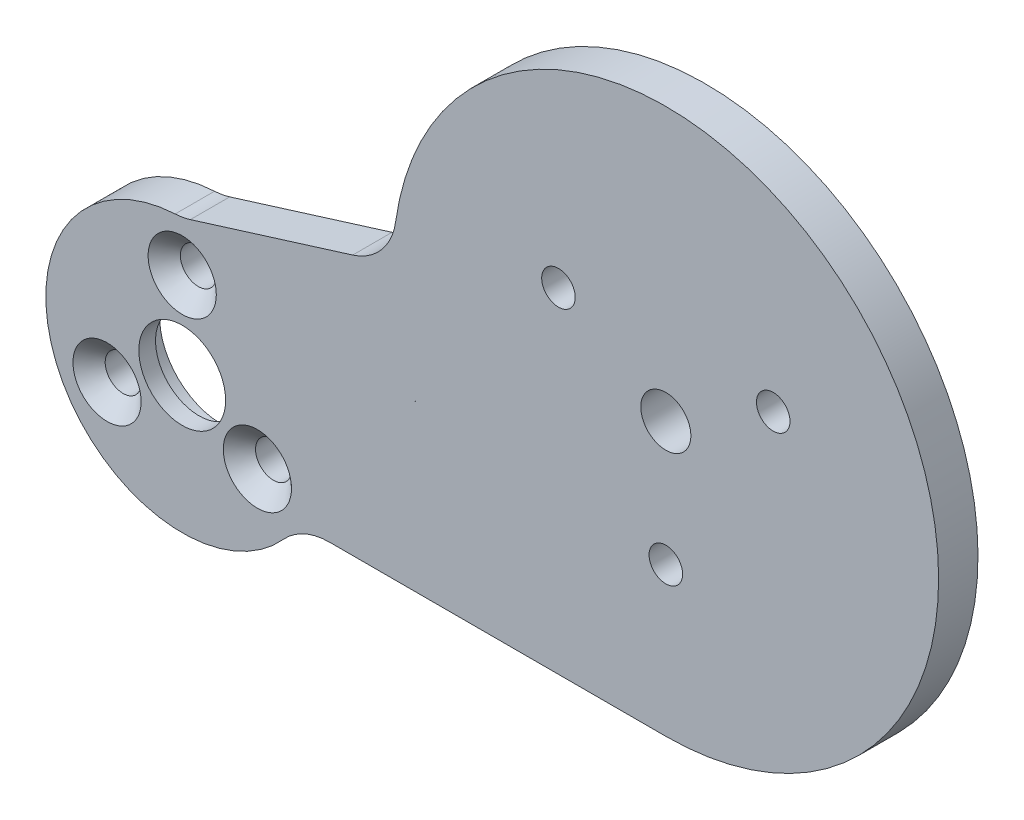
from build123d import *

# Parameters (mm, degrees)
SKETCH1_R                                         = 3.50012
BODY_DEPTH                                        = 3.175
CSK_FOR_M2_5_FLAT_HEAD_MACHINE_SCREW1_D           = 2.9
CSK_FOR_M2_5_FLAT_HEAD_MACHINE_SCREW1_CSINK_D     = 5.5
CSK_FOR_M2_5_FLAT_HEAD_MACHINE_SCREW1_CSINK_ANGLE = 90
FILLET1_R                                         = 5
F_10_32_TAPPED_HOLE2_D                            = 4.0386
F_10_32_TAPPED_HOLE2_DEPTH                        = 12.03
F_10_32_TAPPED_HOLE2_TIP                          = 1.213317848
F_6_32_TAPPED_HOLE1_D                             = 2.7051
F_6_32_TAPPED_HOLE1_DEPTH                         = 9.39
F_6_32_TAPPED_HOLE1_TIP                           = 0.81269403
SKETCH1_3_R                                       = 5
SKETCH1_3_R_2                                     = 3.50012
MOTOR_COLLAR_RECESS_DEPTH                         = 1.82626


with BuildPart() as part:
    # Sketch1 → Body (new body)
    with BuildSketch(Plane.XY):
        with BuildLine():
            Line((-22, 0), (-39, -5.28767268))
            ThreePointArc((-39, -5.28767268), (-48.587377131, -21.680464141), (-29.59950445, -22))
            Line((-29.59950445, -22), (0, -22))
            ThreePointArc((0, -22), (15.556349186, 15.556349186), (-22, 0))
        make_face()
        with BuildLine():
            ThreePointArc((-20.300723283, -8.478244759), (-20.230414586, -8.644670364), (-20.158741556, -8.810512975))
            Line((-20.158741556, -8.810512975), (-20.159744108, -8.824772966))
            ThreePointArc((-20.159744108, -8.824772966), (-20.22943401, -8.651183524), (-20.300723283, -8.478244759))
        make_face(mode=Mode.SUBTRACT)
        with Locations((-39, -16.28767268)):
            Circle(SKETCH1_R, mode=Mode.SUBTRACT)
    extrude(amount=BODY_DEPTH)

    # CSK for M2.5 Flat Head Machine Screw1 (through all)
    with Locations(Plane(origin=(-39, -9.28767268, 3.175), x_dir=(1, 0, 0), z_dir=(0, 0, 1))):
        with Locations((0, 0), (-6.062177826, -10.5), (6.062177826, -10.5)):
            CounterSinkHole(CSK_FOR_M2_5_FLAT_HEAD_MACHINE_SCREW1_D / 2, CSK_FOR_M2_5_FLAT_HEAD_MACHINE_SCREW1_CSINK_D / 2, counter_sink_angle=CSK_FOR_M2_5_FLAT_HEAD_MACHINE_SCREW1_CSINK_ANGLE)

    # Fillet1
    fillet1_edges = [part.edges().sort_by_distance(p)[0] for p in [
        (-29.59950445, -22, 1.5875),
        (-39, -5.28767268, 1.5875),
        (-22, 0, 1.5875),
    ]]
    fillet(fillet1_edges, radius=FILLET1_R)

    # #10-32 Tapped Hole2
    with Locations(Plane.XY.offset(3.175)):
        with Locations((0, 0)):
            Hole(F_10_32_TAPPED_HOLE2_D / 2, depth=F_10_32_TAPPED_HOLE2_DEPTH)
            with Locations((0, 0, -(F_10_32_TAPPED_HOLE2_DEPTH + F_10_32_TAPPED_HOLE2_TIP / 2))):  # 118° drill point
                Cone(0, F_10_32_TAPPED_HOLE2_D / 2, F_10_32_TAPPED_HOLE2_TIP, mode=Mode.SUBTRACT)

    # #6-32 Tapped Hole1
    with Locations(Plane(origin=(-8.660254038, 5, 0), x_dir=(-1, 0, 0), z_dir=(0, 0, -1))):
        with Locations((0, 0), (-17.320508076, 0), (-8.660254038, -15)):
            Hole(F_6_32_TAPPED_HOLE1_D / 2, depth=F_6_32_TAPPED_HOLE1_DEPTH)
            with Locations((0, 0, -(F_6_32_TAPPED_HOLE1_DEPTH + F_6_32_TAPPED_HOLE1_TIP / 2))):  # 118° drill point
                Cone(0, F_6_32_TAPPED_HOLE1_D / 2, F_6_32_TAPPED_HOLE1_TIP, mode=Mode.SUBTRACT)

    # Sketch1<3> → Motor Collar Recess (cut)
    with BuildSketch(Plane.XY):
        with Locations((-39, -16.28767268)):
            Circle(SKETCH1_3_R)
        with Locations((-39, -16.28767268)):
            Circle(SKETCH1_3_R_2, mode=Mode.SUBTRACT)
    extrude(amount=MOTOR_COLLAR_RECESS_DEPTH, mode=Mode.SUBTRACT)


solid = part.part
